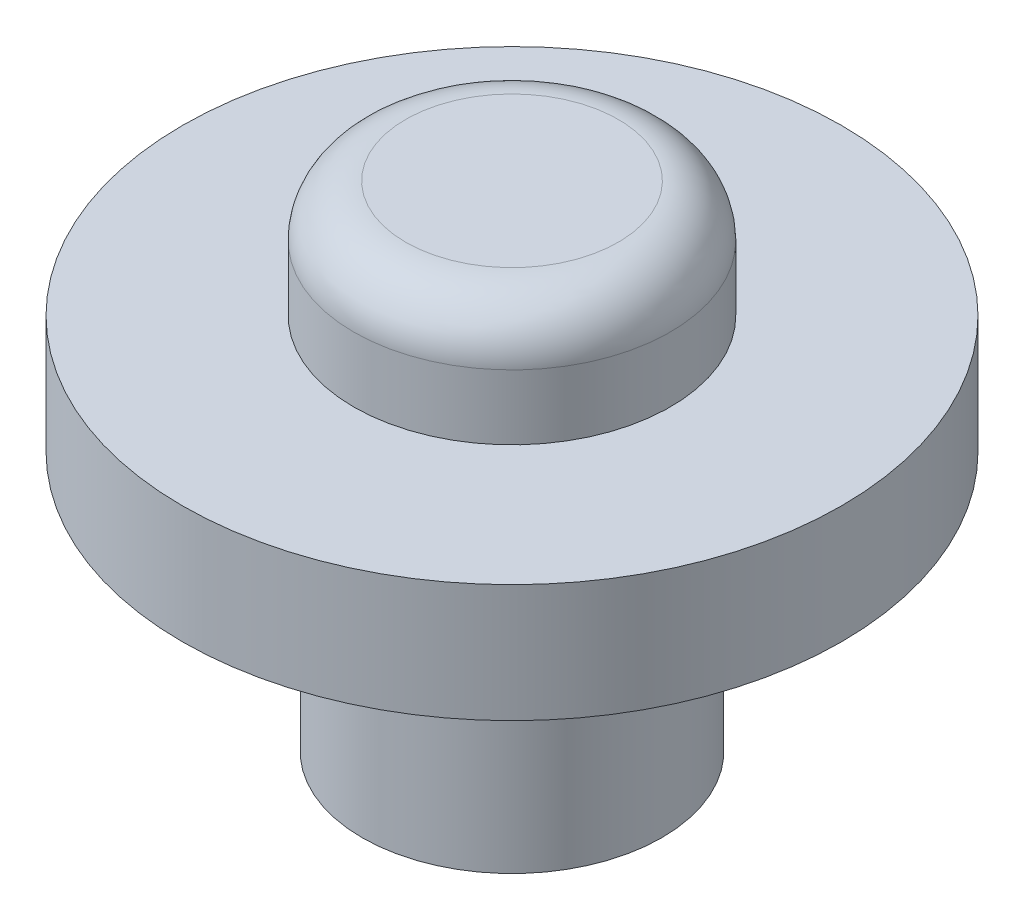
from build123d import *

# Parameters (mm, degrees)
SKETCH1_R           = 5.775
BOSS_EXTRUDE1_DEPTH = 10
SKETCH2_R           = 12.7
BOSS_EXTRUDE2_DEPTH = 4.54
SKETCH3_R           = 6.1
BOSS_EXTRUDE3_DEPTH = 4.5
FILLET1_R           = 2


with BuildPart() as part:
    # Sketch1 → Boss-Extrude1 (new body)
    with BuildSketch(Plane(origin=(0, 0, 0), x_dir=(1, 0, 0), z_dir=(0, 1, 0))):
        with Locations(Location((0, 0, 0), (0, 0, 270))):
            Circle(SKETCH1_R)
    extrude(amount=-BOSS_EXTRUDE1_DEPTH)

    # Sketch2 → Boss-Extrude2 (add)
    with BuildSketch(Plane(origin=(0, 0, 0), x_dir=(1, 0, 0), z_dir=(0, 1, 0))):
        with Locations(Location((0, 0, 0), (0, 0, 270))):
            Circle(SKETCH2_R)
    extrude(amount=BOSS_EXTRUDE2_DEPTH)

    # Sketch3 → Boss-Extrude3 (add)
    with BuildSketch(Plane(origin=(0, 4.54, 0), x_dir=(1, 0, 0), z_dir=(0, 1, 0))):
        with Locations(Location((0, 0, 0), (0, 0, 270))):
            Circle(SKETCH3_R)
    extrude(amount=BOSS_EXTRUDE3_DEPTH)

    # Fillet1
    fillet1_edges = [part.edges().sort_by_distance(p)[0] for p in [
        (0, 9.04, -6.1),
    ]]
    fillet(fillet1_edges, radius=FILLET1_R)


solid = part.part
